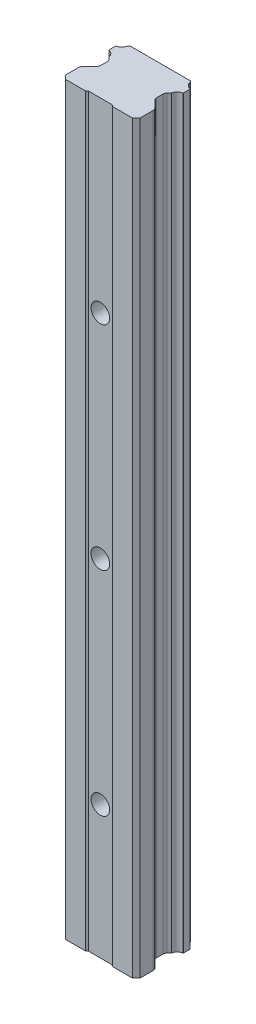
from build123d import *

# Parameters (mm, degrees)
EXTRUDE_1_DEPTH        = 280
SKETCH_2_R             = 5.5
CUT_EXTRUDE_1_DEPTH    = 9
SKETCH_3_R             = 3.5
CUT_EXTRUDE_2_DEPTH    = 281.699127181
PATTERN_LINEAR_1_COUNT = 4
PATTERN_LINEAR_1_PITCH = 80


with BuildPart() as part:
    # 草图1 → 凸台-拉伸1 (new body)
    with BuildSketch(Plane(origin=(0, 0, 0), x_dir=(1, 0, 0), z_dir=(0, 1, 0))):
        with BuildLine():
            Line((11.758193654, -0.458193653), (11.300000001, 0))
            Line((11.300000001, 0), (-11.299999999, 0))
            Line((-11.299999999, 0), (-11.758193652, -0.458193653))
            ThreePointArc((-11.758193652, -0.458193653), (-11.768448168, -0.468969729), (-11.778155913, -0.480240869))
            ThreePointArc((-11.778155913, -0.480240869), (-12.478076595, -1.902541611), (-13.892618036, -2.618014092))
            ThreePointArc((-13.892618036, -2.618014092), (-13.971832127, -2.721095863), (-13.999999999, -2.848010379))
            Line((-13.999999999, -2.848010379), (-13.999999999, -5.15198962))
            ThreePointArc((-13.999999999, -5.15198962), (-13.971832127, -5.278904137), (-13.892618036, -5.381985907))
            ThreePointArc((-13.892618036, -5.381985907), (-12.478076595, -6.097458389), (-11.778155913, -7.519759131))
            ThreePointArc((-11.778155913, -7.519759131), (-11.768448168, -7.531030271), (-11.758193652, -7.541806347))
            Line((-11.758193652, -7.541806347), (-10.939339827, -8.360660172))
            ThreePointArc((-10.939339827, -8.360660172), (-10.614191318, -8.847269563), (-10.5, -9.421264856))
            Line((-10.5, -9.421264856), (-10.5, -11.878679656))
            ThreePointArc((-10.5, -11.878679656), (-10.614180701, -12.452704805), (-10.939339828, -12.939339828))
            Line((-10.939339828, -12.939339828), (-13.560660172, -15.560660172))
            ThreePointArc((-13.560660172, -15.560660172), (-13.88581399, -16.047282379), (-14, -16.6212926))
            Line((-14, -16.6212926), (-14, -21.5))
            Line((-14, -21.5), (-12.5, -23))
            Line((-12.5, -23), (-5, -23))
            Line((-5, -23), (-4.5, -22.5))
            Line((-4.5, -22.5), (4.5, -22.5))
            Line((4.5, -22.5), (5, -23))
            Line((5, -23), (12.5, -23))
            Line((12.5, -23), (14, -21.5))
            Line((14, -21.5), (14, -16.621320344))
            ThreePointArc((14, -16.621320344), (13.885819299, -16.047295195), (13.560660172, -15.560660172))
            Line((13.560660172, -15.560660172), (10.939339828, -12.939339828))
            ThreePointArc((10.939339828, -12.939339828), (10.61418601, -12.452717621), (10.5, -11.8787074))
            Line((10.5, -11.8787074), (10.5, -9.421320344))
            ThreePointArc((10.5, -9.421320344), (10.614180701, -8.847295195), (10.939339828, -8.360660172))
            Line((10.939339828, -8.360660172), (11.758193653, -7.541806347))
            ThreePointArc((11.758193653, -7.541806347), (11.768448169, -7.531030271), (11.778155914, -7.519759131))
            ThreePointArc((11.778155914, -7.519759131), (12.478076596, -6.097458389), (13.892618037, -5.381985908))
            ThreePointArc((13.892618037, -5.381985908), (13.971832128, -5.278904137), (14, -5.15198962))
            Line((14, -5.15198962), (14, -2.848010379))
            ThreePointArc((14, -2.848010379), (13.971832128, -2.721095863), (13.892618037, -2.618014092))
            ThreePointArc((13.892618037, -2.618014092), (12.478076596, -1.902541611), (11.778155915, -0.480240869))
            ThreePointArc((11.778155915, -0.480240869), (11.76844817, -0.468969728), (11.758193654, -0.458193653))
        make_face()
    extrude(amount=EXTRUDE_1_DEPTH)

    # 草图2 → 切除-拉伸1 (cut)
    with BuildSketch(Plane(origin=(0, 0, 0), x_dir=(-1, 0, 0), z_dir=(0, 0, -1))):
        with Locations((0, 50)):
            Circle(SKETCH_2_R)
    cut_extrude_1 = extrude(amount=-CUT_EXTRUDE_1_DEPTH, mode=Mode.SUBTRACT)

    # 草图3 → 切除-拉伸2 (cut, through all)
    with BuildSketch(Plane(origin=(0, 0, 9), x_dir=(-1, 0, 0), z_dir=(0, 0, -1))):
        with Locations((0, 50)):
            Circle(SKETCH_3_R)
    cut_extrude_2 = extrude(amount=-CUT_EXTRUDE_2_DEPTH, mode=Mode.SUBTRACT)

    # 阵列(线性)1: 切除-拉伸1, 切除-拉伸2 ×4
    with Locations(*[(0, i * PATTERN_LINEAR_1_PITCH, 0) for i in range(1, PATTERN_LINEAR_1_COUNT)]):
        add(cut_extrude_1, mode=Mode.SUBTRACT)
        add(cut_extrude_2, mode=Mode.SUBTRACT)


solid = part.part
